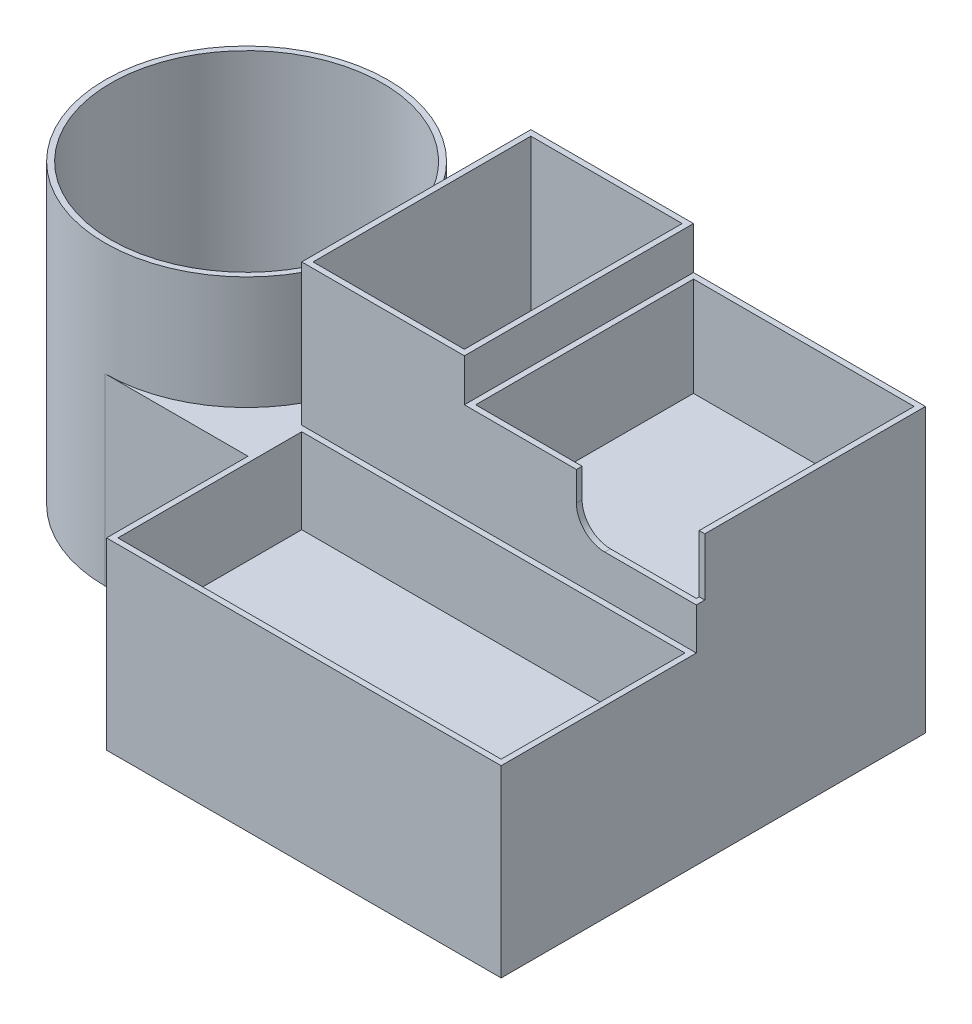
from build123d import *

# Parameters (mm, degrees)
BOSS_EXTRUDE1_DEPTH = 65
BOSS_EXTRUDE3_START = -60
SKETCH2_R           = 48
BOSS_EXTRUDE3_DEPTH = 100
CUT_EXTRUDE1_START  = -50
SKETCH2_6_R         = 48
CUT_EXTRUDE1_DEPTH  = 50
BOSS_EXTRUDE6_START = -50
SKETCH2_9_W         = 57.5
SKETCH2_9_H         = 81
SKETCH2_9_W_2       = 53.5
SKETCH2_9_H_2       = 77
BOSS_EXTRUDE6_DEPTH = 100
SKETCH2_10_W        = 53.5
SKETCH2_10_H        = 77
CUT_EXTRUDE2_DEPTH  = 50
SKETCH2_11_W        = 82
SKETCH2_11_H        = 81
SKETCH2_11_W_2      = 78
SKETCH2_11_H_2      = 77
BOSS_EXTRUDE7_DEPTH = 35
CUT_EXTRUDE4_DEPTH  = 3
SKETCH10_W          = 139.5
SKETCH10_H          = 50
BOSS_EXTRUDE9_DEPTH = 65
SKETCH10_3_W        = 139.5
SKETCH10_3_H        = 50
CUT_EXTRUDE5_DEPTH  = 20
SKETCH7_W           = 139.5
SKETCH7_H           = 50
BOSS_EXTRUDE8_DEPTH = 65
SKETCH8_W           = 135.5
SKETCH8_H           = 65
CUT_EXTRUDE6_DEPTH  = 30


with BuildPart() as part:
    # Sketch1 → Boss-Extrude1 (new body)
    with BuildSketch(Plane(origin=(0, 0, 0), x_dir=(1, 0, 0), z_dir=(0, 1, 0))):
        with BuildLine():
            Line((-70, -50), (120, -50))
            Line((120, -50), (120, 50))
            Line((120, 50), (-71, 50))
            ThreePointArc((-71, 50), (-105.648232278, 35.648232278), (-120, 1))
            Line((-120, 1), (-120, 0))
            ThreePointArc((-120, 0), (-105.355339059, -35.355339059), (-70, -50))
        make_face()
    extrude(amount=BOSS_EXTRUDE1_DEPTH)

    # Sketch2 → Boss-Extrude3 (add)
    with BuildSketch(Plane(origin=(0, 65, 0), x_dir=(1, 0, 0), z_dir=(0, 1, 0)).offset(BOSS_EXTRUDE3_START)):
        with BuildLine():
            ThreePointArc((-70, -50), (-34.644660941, -35.355339059), (-20, 0))
            ThreePointArc((-20, 0), (-70, 50), (-120, 0))
            ThreePointArc((-120, 0), (-105.355339059, -35.355339059), (-70, -50))
        make_face()
        with Locations((-70, 0)):
            Circle(SKETCH2_R, mode=Mode.SUBTRACT)
    extrude(amount=BOSS_EXTRUDE3_DEPTH)

    # Sketch2<6> → Cut-Extrude1 (cut)
    with BuildSketch(Plane(origin=(0, 65, 0), x_dir=(1, 0, 0), z_dir=(0, 1, 0)).offset(CUT_EXTRUDE1_START)):
        with Locations((-70, 0)):
            Circle(SKETCH2_6_R)
    extrude(amount=CUT_EXTRUDE1_DEPTH, mode=Mode.SUBTRACT)

    # Sketch2<9> → Boss-Extrude6 (add)
    with BuildSketch(Plane(origin=(0, 65, 0), x_dir=(1, 0, 0), z_dir=(0, 1, 0)).offset(BOSS_EXTRUDE6_START)):
        with Locations((9.25, 9.5)):
            Rectangle(SKETCH2_9_W, SKETCH2_9_H)
        with Locations((9.25, 9.5)):
            Rectangle(SKETCH2_9_W_2, SKETCH2_9_H_2, mode=Mode.SUBTRACT)
    extrude(amount=BOSS_EXTRUDE6_DEPTH)

    # Sketch2<10> → Cut-Extrude2 (cut)
    with BuildSketch(Plane(origin=(0, 65, 0), x_dir=(1, 0, 0), z_dir=(0, 1, 0))):
        with Locations((9.25, 9.5)):
            Rectangle(SKETCH2_10_W, SKETCH2_10_H)
    extrude(amount=-CUT_EXTRUDE2_DEPTH, mode=Mode.SUBTRACT)

    # Sketch2<11> → Boss-Extrude7 (add)
    with BuildSketch(Plane(origin=(0, 65, 0), x_dir=(1, 0, 0), z_dir=(0, 1, 0))):
        with Locations((79, 9.5)):
            Rectangle(SKETCH2_11_W, SKETCH2_11_H)
        with Locations((79, 9.5)):
            Rectangle(SKETCH2_11_W_2, SKETCH2_11_H_2, mode=Mode.SUBTRACT)
    extrude(amount=BOSS_EXTRUDE7_DEPTH)

    # Sketch5 → Cut-Extrude4 (cut)
    with BuildSketch(Plane.XY.offset(31)):
        with BuildLine():
            Line((77.611486798, 100), (77.611486798, 89.725450473))
            ThreePointArc((77.611486798, 89.725450473), (80.540418986, 82.654382661), (87.611486798, 79.725450473))
            Line((87.611486798, 79.725450473), (120, 79.725450473))
            Line((120, 79.725450473), (120, 100))
            Line((120, 100), (77.611486798, 100))
        make_face()
    extrude(amount=-CUT_EXTRUDE4_DEPTH, mode=Mode.SUBTRACT)

    # Sketch10 → Boss-Extrude9 (add)
    with BuildSketch(Plane(origin=(0, 65, 0), x_dir=(1, 0, 0), z_dir=(0, 1, 0))):
        with Locations((50.25, -75)):
            Rectangle(SKETCH10_W, SKETCH10_H)
    extrude(amount=-BOSS_EXTRUDE9_DEPTH)

    # Sketch10<3> → Cut-Extrude5 (cut)
    with BuildSketch(Plane(origin=(0, 65, 0), x_dir=(1, 0, 0), z_dir=(0, 1, 0))):
        with Locations((50.25, -75)):
            Rectangle(SKETCH10_3_W, SKETCH10_3_H)
    extrude(amount=-CUT_EXTRUDE5_DEPTH, mode=Mode.SUBTRACT)

    # Sketch7 → Boss-Extrude8 (add)
    with BuildSketch(Plane(origin=(0, 65, 0), x_dir=(1, 0, 0), z_dir=(0, 1, 0))):
        with Locations((50.25, -75)):
            Rectangle(SKETCH7_W, SKETCH7_H)
    extrude(amount=-BOSS_EXTRUDE8_DEPTH)

    # Sketch8 → Cut-Extrude6 (cut)
    with BuildSketch(Plane(origin=(0, 65, 0), x_dir=(1, 0, 0), z_dir=(0, 1, 0))):
        with Locations((50.25, -65.5)):
            Rectangle(SKETCH8_W, SKETCH8_H)
    extrude(amount=-CUT_EXTRUDE6_DEPTH, mode=Mode.SUBTRACT)


solid = part.part
